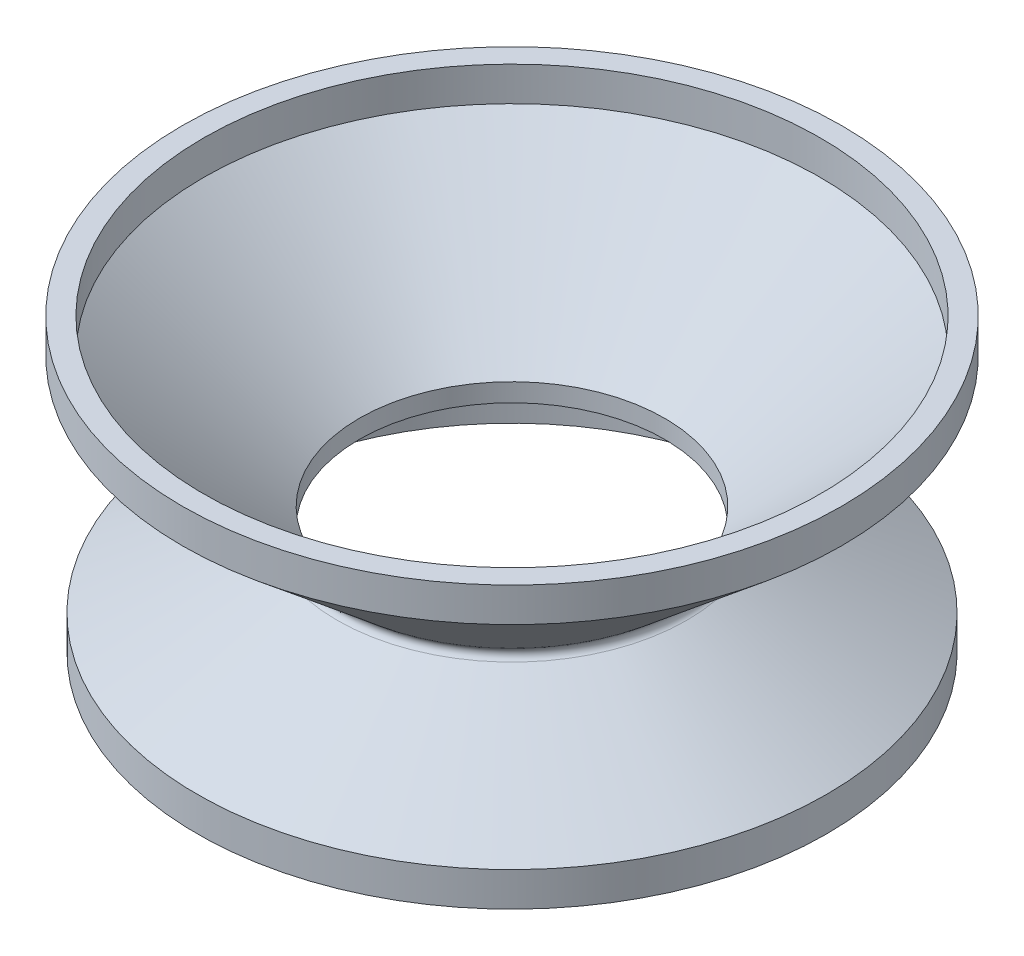
from build123d import *

# Parameters (mm, degrees)
FILLET2_R           = 0.4
SKETCH2_R           = 19.244579061
SKETCH2_R_2         = 18
BOSS_EXTRUDE1_DEPTH = 2
SKETCH3_R           = 18.370804359
SKETCH3_R_2         = 16.370804359
BOSS_EXTRUDE2_DEPTH = 2


with BuildPart() as part:
    # Sketch1 → Revolve1 (revolve)
    with BuildSketch(Plane.XY):
        Polygon((0.662781953, 0), (-8.871246788, 8), (-7.626667727, 8), (1.462781953, 0.373046127), (1.462781953, -0.692820323), (-5.997472085, -5), (-7.997472085, -5), align=None)
    revolve(axis=Axis((10.373332273, 7.609018033, 0), (0, -1, 0)))

    # Fillet2
    fillet2_edges = [part.edges().sort_by_distance(p)[0] for p in [
        (20.083882594, 0, 0),
    ]]
    fillet(fillet2_edges, radius=FILLET2_R)

    # Sketch2 → Boss-Extrude1 (add)
    with BuildSketch(Plane(origin=(0, 8, 0), x_dir=(1, 0, 0), z_dir=(0, 1, 0))):
        with Locations(Location((10.373332273, 0, 0), (0, 0, 180))):
            Circle(SKETCH2_R)
        with Locations(Location((10.373332273, 0, 0), (0, 0, 180))):
            Circle(SKETCH2_R_2, mode=Mode.SUBTRACT)
    extrude(amount=BOSS_EXTRUDE1_DEPTH)

    # Sketch3 → Boss-Extrude2 (add)
    with BuildSketch(Plane.XZ.offset(5)):
        with Locations((10.373332273, 0)):
            Circle(SKETCH3_R)
        with Locations(Location((10.373332273, 0, 0), (0, 0, 180))):
            Circle(SKETCH3_R_2, mode=Mode.SUBTRACT)
    extrude(amount=BOSS_EXTRUDE2_DEPTH)


solid = part.part
